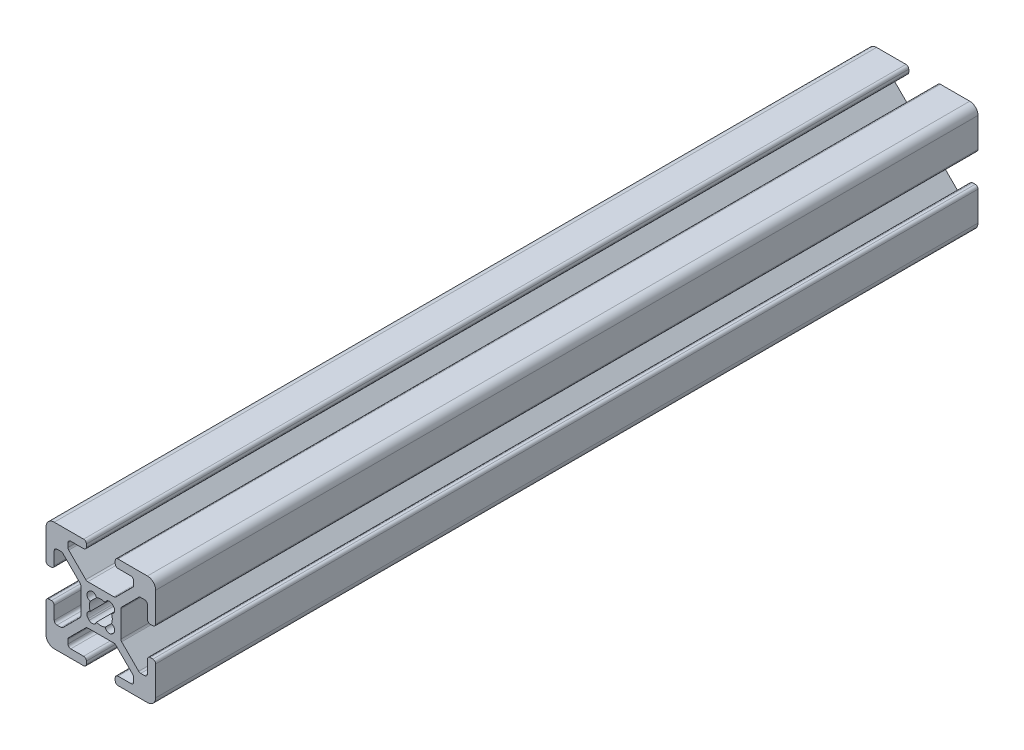
from build123d import *

# Parameters (mm, degrees)
BOSS_EXTRUDE1_DEPTH = 150


with BuildPart() as part:
    # Sketch2 → Boss-Extrude1 (new body)
    with BuildSketch(Plane.XY):
        with BuildLine():
            Line((-10, -3.138), (-10, -8.5))
            ThreePointArc((-10, -8.5), (-9.560660172, -9.560660172), (-8.5, -10))
            Line((-8.5, -10), (-3.138, -10))
            ThreePointArc((-3.138, -10), (-2.778789755, -9.851210245), (-2.63, -9.492))
            Line((-2.63, -9.492), (-2.63, -9.008))
            ThreePointArc((-2.63, -9.008), (-2.778789755, -8.648789755), (-3.138, -8.5))
            Line((-3.138, -8.5), (-5.487, -8.5))
            ThreePointArc((-5.487, -8.5), (-5.846210245, -8.351210245), (-5.995, -7.992))
            Line((-5.995, -7.992), (-5.995, -7.266240833))
            ThreePointArc((-5.995, -7.266240833), (-5.956330803, -7.07183765), (-5.846210245, -6.907030588))
            Line((-5.846210245, -6.907030588), (-2.742969412, -3.803789755))
            ThreePointArc((-2.742969412, -3.803789755), (-2.57816235, -3.693669197), (-2.383759167, -3.655))
            Line((-2.383759167, -3.655), (2.38407951, -3.655))
            ThreePointArc((2.38407951, -3.655), (2.578482694, -3.693669197), (2.743289755, -3.803789755))
            Line((2.743289755, -3.803789755), (5.846210245, -6.906710245))
            ThreePointArc((5.846210245, -6.906710245), (5.956330803, -7.071517306), (5.995, -7.26592049))
            Line((5.995, -7.26592049), (5.995, -7.992))
            ThreePointArc((5.995, -7.992), (5.846210245, -8.351210245), (5.487, -8.5))
            Line((5.487, -8.5), (3.138, -8.5))
            ThreePointArc((3.138, -8.5), (2.778789755, -8.648789755), (2.63, -9.008))
            Line((2.63, -9.008), (2.63, -9.492))
            ThreePointArc((2.63, -9.492), (2.778789755, -9.851210245), (3.138, -10))
            Line((3.138, -10), (8.5, -10))
            ThreePointArc((8.5, -10), (9.560660172, -9.560660172), (10, -8.5))
            Line((10, -8.5), (10, -3.138))
            ThreePointArc((10, -3.138), (9.851210245, -2.778789755), (9.492, -2.63))
            Line((9.492, -2.63), (9.008, -2.63))
            ThreePointArc((9.008, -2.63), (8.648789755, -2.778789755), (8.5, -3.138))
            Line((8.5, -3.138), (8.5, -5.487))
            ThreePointArc((8.5, -5.487), (8.351210245, -5.846210245), (7.992, -5.995))
            Line((7.992, -5.995), (7.266240833, -5.995))
            ThreePointArc((7.266240833, -5.995), (7.07183765, -5.956330803), (6.907030588, -5.846210245))
            Line((6.907030588, -5.846210245), (3.803789755, -2.742969412))
            ThreePointArc((3.803789755, -2.742969412), (3.693669197, -2.57816235), (3.655, -2.383759167))
            Line((3.655, -2.383759167), (3.655, 2.38407951))
            ThreePointArc((3.655, 2.38407951), (3.693669197, 2.578482694), (3.803789755, 2.743289755))
            Line((3.803789755, 2.743289755), (6.906710245, 5.846210245))
            ThreePointArc((6.906710245, 5.846210245), (7.071517306, 5.956330803), (7.26592049, 5.995))
            Line((7.26592049, 5.995), (7.992, 5.995))
            ThreePointArc((7.992, 5.995), (8.351210245, 5.846210245), (8.5, 5.487))
            Line((8.5, 5.487), (8.5, 3.138))
            ThreePointArc((8.5, 3.138), (8.648789755, 2.778789755), (9.008, 2.63))
            Line((9.008, 2.63), (9.492, 2.63))
            ThreePointArc((9.492, 2.63), (9.851210245, 2.778789755), (10, 3.138))
            Line((10, 3.138), (10, 8.5))
            ThreePointArc((10, 8.5), (9.560660172, 9.560660172), (8.5, 10))
            Line((8.5, 10), (3.138, 10))
            ThreePointArc((3.138, 10), (2.778789755, 9.851210245), (2.63, 9.492))
            Line((2.63, 9.492), (2.63, 9.008))
            ThreePointArc((2.63, 9.008), (2.778789755, 8.648789755), (3.138, 8.5))
            Line((3.138, 8.5), (5.487, 8.5))
            ThreePointArc((5.487, 8.5), (5.846210245, 8.351210245), (5.995, 7.992))
            Line((5.995, 7.992), (5.995, 7.266240833))
            ThreePointArc((5.995, 7.266240833), (5.956330803, 7.07183765), (5.846210245, 6.907030588))
            Line((5.846210245, 6.907030588), (2.742969412, 3.803789755))
            ThreePointArc((2.742969412, 3.803789755), (2.57816235, 3.693669197), (2.383759167, 3.655))
            Line((2.383759167, 3.655), (-2.38407951, 3.655))
            ThreePointArc((-2.38407951, 3.655), (-2.578482694, 3.693669197), (-2.743289755, 3.803789755))
            Line((-2.743289755, 3.803789755), (-5.846210245, 6.906710245))
            ThreePointArc((-5.846210245, 6.906710245), (-5.956330803, 7.071517306), (-5.995, 7.26592049))
            Line((-5.995, 7.26592049), (-5.995, 7.992))
            ThreePointArc((-5.995, 7.992), (-5.846210245, 8.351210245), (-5.487, 8.5))
            Line((-5.487, 8.5), (-3.138, 8.5))
            ThreePointArc((-3.138, 8.5), (-2.778789755, 8.648789755), (-2.63, 9.008))
            Line((-2.63, 9.008), (-2.63, 9.492))
            ThreePointArc((-2.63, 9.492), (-2.778789755, 9.851210245), (-3.138, 10))
            Line((-3.138, 10), (-8.5, 10))
            ThreePointArc((-8.5, 10), (-9.560660172, 9.560660172), (-10, 8.5))
            Line((-10, 8.5), (-10, 3.138))
            ThreePointArc((-10, 3.138), (-9.851210245, 2.778789755), (-9.492, 2.63))
            Line((-9.492, 2.63), (-9.008, 2.63))
            ThreePointArc((-9.008, 2.63), (-8.648789755, 2.778789755), (-8.5, 3.138))
            Line((-8.5, 3.138), (-8.5, 5.487))
            ThreePointArc((-8.5, 5.487), (-8.351210245, 5.846210245), (-7.992, 5.995))
            Line((-7.992, 5.995), (-7.266240833, 5.995))
            ThreePointArc((-7.266240833, 5.995), (-7.07183765, 5.956330803), (-6.907030588, 5.846210245))
            Line((-6.907030588, 5.846210245), (-3.803789755, 2.742969412))
            ThreePointArc((-3.803789755, 2.742969412), (-3.693669197, 2.57816235), (-3.655, 2.383759167))
            Line((-3.655, 2.383759167), (-3.655, -2.38407951))
            ThreePointArc((-3.655, -2.38407951), (-3.693669197, -2.578482694), (-3.803789755, -2.743289755))
            Line((-3.803789755, -2.743289755), (-6.906710245, -5.846210245))
            ThreePointArc((-6.906710245, -5.846210245), (-7.071517306, -5.956330803), (-7.26592049, -5.995))
            Line((-7.26592049, -5.995), (-7.992, -5.995))
            ThreePointArc((-7.992, -5.995), (-8.351210245, -5.846210245), (-8.5, -5.487))
            Line((-8.5, -5.487), (-8.5, -3.138))
            ThreePointArc((-8.5, -3.138), (-8.648789755, -2.778789755), (-9.008, -2.63))
            Line((-9.008, -2.63), (-9.492, -2.63))
            ThreePointArc((-9.492, -2.63), (-9.851210245, -2.778789755), (-10, -3.138))
        make_face()
        with BuildLine():
            Line((-2.124493037, 2.304493037), (-2.304493037, 2.124493037))
            ThreePointArc((-2.304493037, 2.124493037), (-2.506016078, 1.35638567), (-1.935777391, 0.803729988))
            ThreePointArc((-1.935777391, 0.803729988), (-2.096, 0), (-1.935777391, -0.803729988))
            ThreePointArc((-1.935777391, -0.803729988), (-2.506016078, -1.35638567), (-2.304493037, -2.124493037))
            Line((-2.304493037, -2.124493037), (-2.124493037, -2.304493037))
            ThreePointArc((-2.124493037, -2.304493037), (-1.35638567, -2.506016078), (-0.803729988, -1.935777391))
            ThreePointArc((-0.803729988, -1.935777391), (0, -2.096), (0.803729988, -1.935777391))
            ThreePointArc((0.803729988, -1.935777391), (1.35638567, -2.506016078), (2.124493037, -2.304493037))
            Line((2.124493037, -2.304493037), (2.304493037, -2.124493037))
            ThreePointArc((2.304493037, -2.124493037), (2.506016078, -1.35638567), (1.935777391, -0.803729988))
            ThreePointArc((1.935777391, -0.803729988), (2.096, 0), (1.935777391, 0.803729988))
            ThreePointArc((1.935777391, 0.803729988), (2.506016078, 1.35638567), (2.304493037, 2.124493037))
            Line((2.304493037, 2.124493037), (2.124493037, 2.304493037))
            ThreePointArc((2.124493037, 2.304493037), (1.35638567, 2.506016078), (0.803729988, 1.935777391))
            ThreePointArc((0.803729988, 1.935777391), (0, 2.096), (-0.803729988, 1.935777391))
            ThreePointArc((-0.803729988, 1.935777391), (-1.35638567, 2.506016078), (-2.124493037, 2.304493037))
        make_face(mode=Mode.SUBTRACT)
    extrude(amount=-BOSS_EXTRUDE1_DEPTH)


solid = part.part
